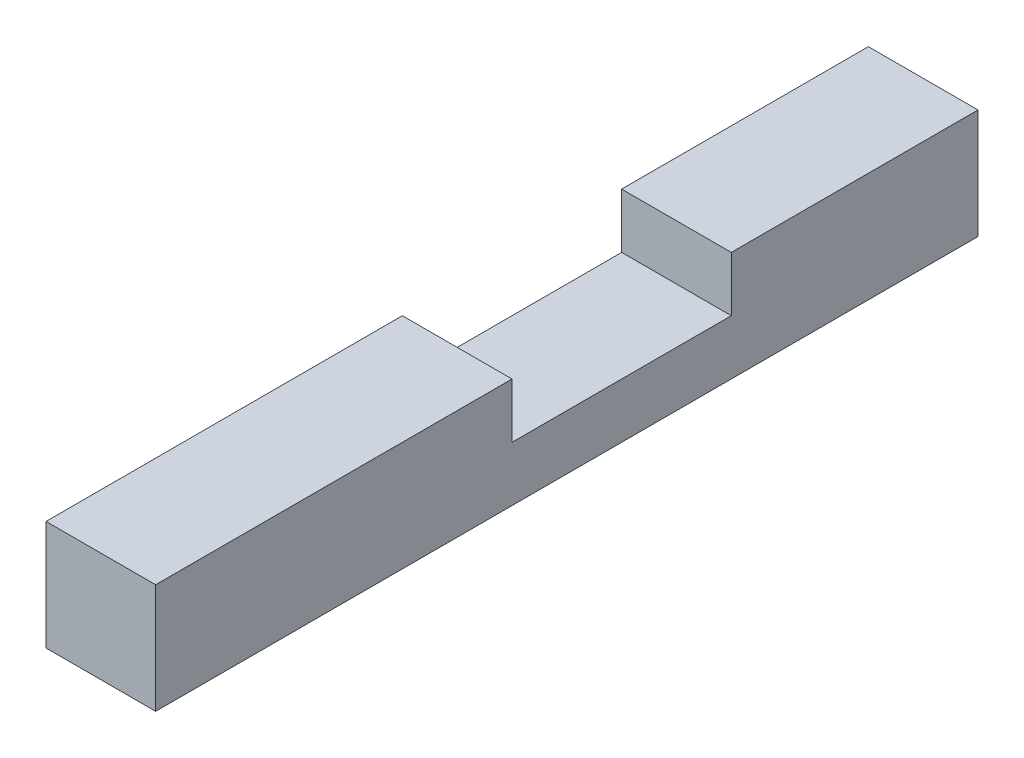
from build123d import *

# Parameters (mm, degrees)
SKETCH_1_W          = 4
SKETCH_1_H          = 4
EXTRUDE_1_DEPTH     = 30
SKETCH_4_W          = 8
SKETCH_4_H          = 2
CUT_EXTRUDE_1_DEPTH = 4


with BuildPart() as part:
    # 草圖1 → 填料-伸長1 (new body)
    with BuildSketch(Plane.XY):
        Rectangle(SKETCH_1_W, SKETCH_1_H)
    extrude(amount=EXTRUDE_1_DEPTH)

    # 草圖4 → 除料-伸長1 (cut)
    with BuildSketch(Plane.ZY.offset(2)):
        with Locations((13, 1)):
            Rectangle(SKETCH_4_W, SKETCH_4_H)
    extrude(amount=-CUT_EXTRUDE_1_DEPTH, mode=Mode.SUBTRACT)


solid = part.part
